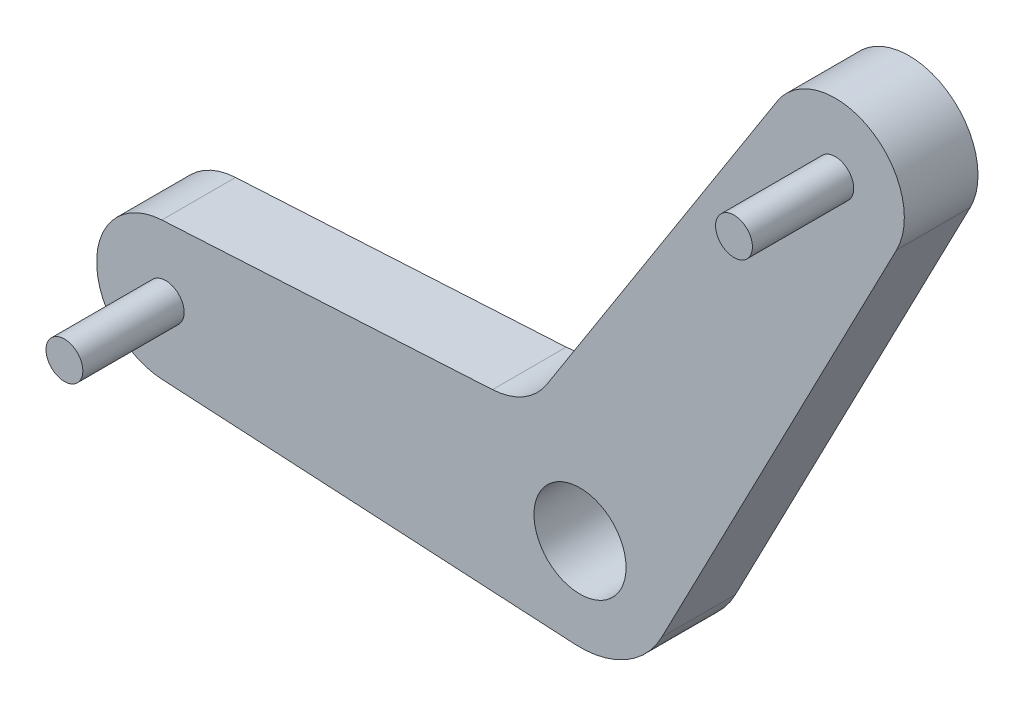
from build123d import *

# Parameters (mm, degrees)
EXTRUDE_1_DEPTH     = 16
SKETCH_2_R          = 4
EXTRUDE_2_DEPTH     = 22
SKETCH_3_R          = 10
CUT_EXTRUDE_1_DEPTH = 16


with BuildPart() as part:
    # 草图1 → 凸台-拉伸1 (new body)
    with BuildSketch(Plane.XY):
        with BuildLine():
            Line((68.765313927, 89.135523785), (17.753751903, -9.208924659))
            ThreePointArc((17.753751903, -9.208924659), (9.909075677, -17.372686011), (-1.111111111, -19.969111951))
            Line((-1.111111111, -19.969111951), (-90.833333333, -14.976833963))
            ThreePointArc((-90.833333333, -14.976833963), (-105, 0), (-90.833333333, 14.976833963))
            Line((-90.833333333, 14.976833963), (-19.005850553, 18.973422013))
            ThreePointArc((-19.005850553, 18.973422013), (-12.271196702, 20.999365274), (-7.200154901, 25.872202603))
            Line((-7.200154901, 25.872202603), (42.810971014, 104.120270653))
            ThreePointArc((42.810971014, 104.120270653), (62.95, 109.032598336), (68.765313927, 89.135523785))
        make_face()
    extrude(amount=EXTRUDE_1_DEPTH)

    # 草图2 → 凸台-拉伸2 (add)
    with BuildSketch(Plane.XY.offset(16)):
        with Locations(Location((-90, 0, 0), (0, 0, 180))):
            Circle(SKETCH_2_R)
        with Locations(Location((55.45, 96.04221728, 0), (0, 0, 180))):
            Circle(SKETCH_2_R)
    extrude(amount=EXTRUDE_2_DEPTH)

    # 草图3 → 切除-拉伸1 (cut)
    with BuildSketch(Plane.XY):
        Circle(SKETCH_3_R)
    extrude(amount=CUT_EXTRUDE_1_DEPTH, mode=Mode.SUBTRACT)


solid = part.part
